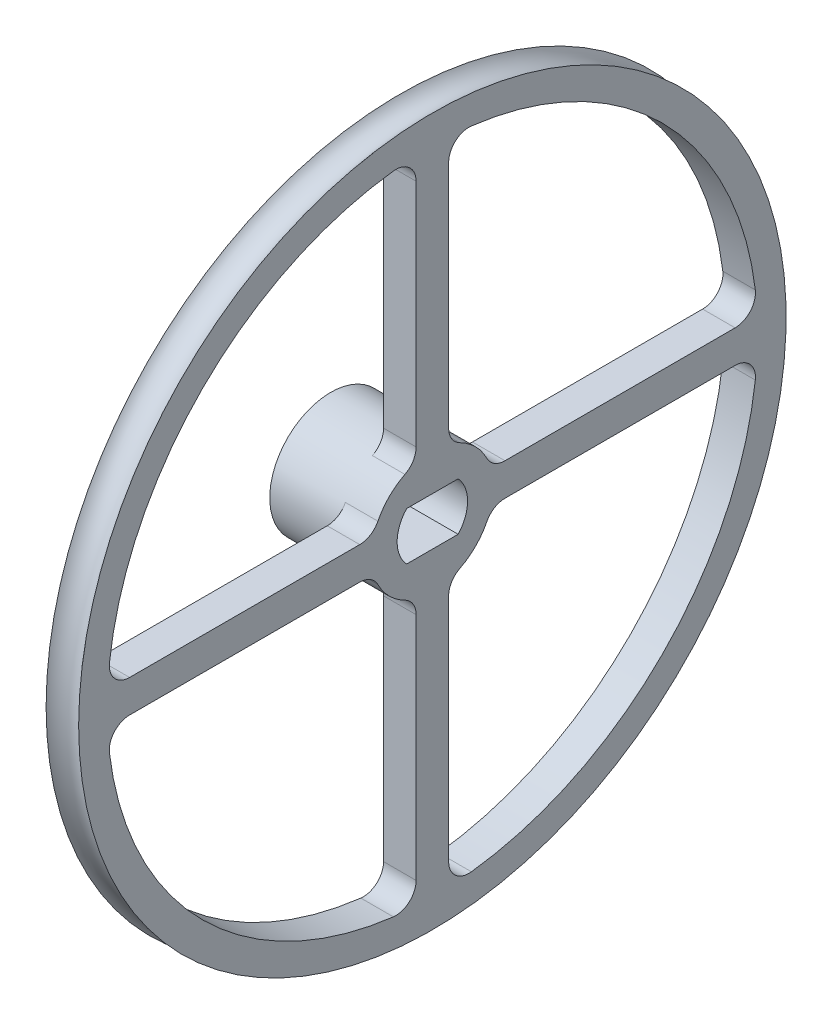
from build123d import *

# Parameters (mm, degrees)
SKETCH2_R           = 4.7625
BOSS_EXTRUDE1_DEPTH = 7.9375
SKETCH3_W           = 22.65
SKETCH3_H           = 2.54
SKETCH3_W_2         = 2.54
SKETCH3_H_2         = 23.525
EXTRUDE_THIN1_DEPTH = 2.54
FILLET1_R           = 1.5875


with BuildPart() as part:
    # Sketch1 → Revolve1 (revolve)
    with BuildSketch(Plane.XY, mode=Mode.PRIVATE) as revolve1_sk:
        with BuildLine():
            Line((-1.27, 25.4), (1.27, 25.4))
            Line((1.27, 25.4), (1.27, 27.6225))
            ThreePointArc((1.27, 27.6225), (0, 26.9875), (-1.27, 27.6225))
            Line((-1.27, 27.6225), (-1.27, 25.4))
        make_face()
    revolve(revolve1_sk.sketch.rotate(Axis((-2.168850248, 0, 0), (1, 0, 0)), 90), axis=Axis((-2.168850248, 0, 0), (1, 0, 0)))



with BuildPart() as body_2:
    # Sketch2 → Boss-Extrude1 (new body)
    with BuildSketch(Plane(origin=(1.27, 0, 0), x_dir=(0, 0, -1), z_dir=(1, 0, 0))):
        Circle(SKETCH2_R)
        with BuildLine():
            Line((-2.011684617, 1.875), (2.011684617, 1.875))
            ThreePointArc((2.011684617, 1.875), (2.75, 0), (2.011684617, -1.875))
            Line((2.011684617, -1.875), (-2.011684617, -1.875))
            ThreePointArc((-2.011684617, -1.875), (-2.75, 0), (-2.011684617, 1.875))
        make_face(mode=Mode.SUBTRACT)
    extrude(amount=-BOSS_EXTRUDE1_DEPTH)


with BuildPart() as part_1:
    add(part.part)

    add(body_2.part)  # Extrude-Thin1 merges body 2
    # Sketch3 → Extrude-Thin1 (add)
    with BuildSketch(Plane(origin=(1.27, 0, 0), x_dir=(0, 0, -1), z_dir=(1, 0, 0))):
        with Locations((-14.075, 0)):
            Rectangle(SKETCH3_W, SKETCH3_H)
        with Locations((0, 13.6375)):
            Rectangle(SKETCH3_W_2, SKETCH3_H_2)
        with Locations((14.075, 0)):
            Rectangle(SKETCH3_W, SKETCH3_H)
        with Locations((0, -13.6375)):
            Rectangle(SKETCH3_W_2, SKETCH3_H_2)
    extrude(amount=-EXTRUDE_THIN1_DEPTH)

    # Fillet1
    fillet1_edges = [part_1.edges().sort_by_distance(p)[0] for p in [
        (0, -1.27, -4.590044254),
        (0, -1.27, -25.368230131),
        (0, 1.27, 25.368230131),
        (0, -1.27, 25.368230131),
        (0, -4.590044254, -1.27),
        (0, -25.368230131, -1.27),
        (0, -4.590044254, 1.27),
        (0, -25.368230131, 1.27),
        (0, 1.27, 4.590044254),
        (0, -1.27, 4.590044254),
        (0, 25.368230131, 1.27),
        (0, 4.590044254, 1.27),
        (0, 4.590044254, -1.27),
        (0, 25.368230131, -1.27),
        (0, 1.27, -4.590044254),
        (0, 1.27, -25.368230131),
    ]]
    fillet(fillet1_edges, radius=FILLET1_R)


solid = part_1.part
